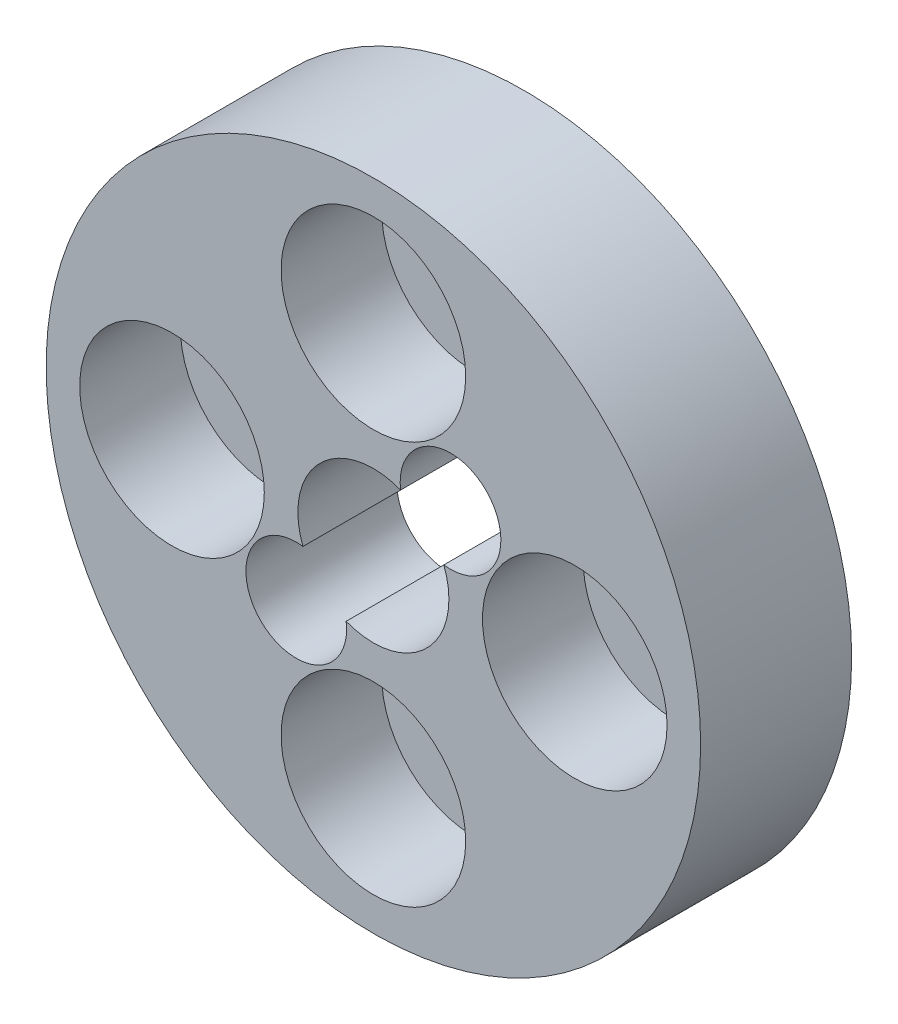
from build123d import *

# Parameters (mm, degrees)
SKETCH1_R           = 9.75
SKETCH1_R_2         = 2.25
SKETCH1_R_3         = 1.5
BOSS_EXTRUDE1_DEPTH = 4.5
SKETCH2_R           = 1.5
CUT_EXTRUDE1_DEPTH  = 15.504309704
SKETCH3_R           = 2.75
CUT_EXTRUDE2_DEPTH  = 3


with BuildPart() as part:
    # Sketch1 → Boss-Extrude1 (new body)
    with BuildSketch(Plane.XY):
        Circle(SKETCH1_R)
        Circle(SKETCH1_R_2, mode=Mode.SUBTRACT)
        with Locations((0, 6)):
            Circle(SKETCH1_R_3, mode=Mode.SUBTRACT)
        with Locations((6, 0)):
            Circle(SKETCH1_R_3, mode=Mode.SUBTRACT)
        with Locations((0, -6)):
            Circle(SKETCH1_R_3, mode=Mode.SUBTRACT)
        with Locations((-6, 0)):
            Circle(SKETCH1_R_3, mode=Mode.SUBTRACT)
    extrude(amount=BOSS_EXTRUDE1_DEPTH)

    # Sketch2 → Cut-Extrude1 (cut, through all)
    with BuildSketch(Plane.XY.offset(4.5)):
        with Locations((2.298097039, 2.298097039)):
            Circle(SKETCH2_R)
        with Locations((-2.298097039, -2.298097039)):
            Circle(SKETCH2_R)
    extrude(amount=-CUT_EXTRUDE1_DEPTH, mode=Mode.SUBTRACT)

    # Sketch3 → Cut-Extrude2 (cut)
    with BuildSketch(Plane.XY.offset(4.5)):
        with Locations((6, 0)):
            Circle(SKETCH3_R)
        with Locations((0, -6)):
            Circle(SKETCH3_R)
        with Locations((-6, 0)):
            Circle(SKETCH3_R)
        with Locations((0, 6)):
            Circle(SKETCH3_R)
    extrude(amount=-CUT_EXTRUDE2_DEPTH, mode=Mode.SUBTRACT)


solid = part.part
